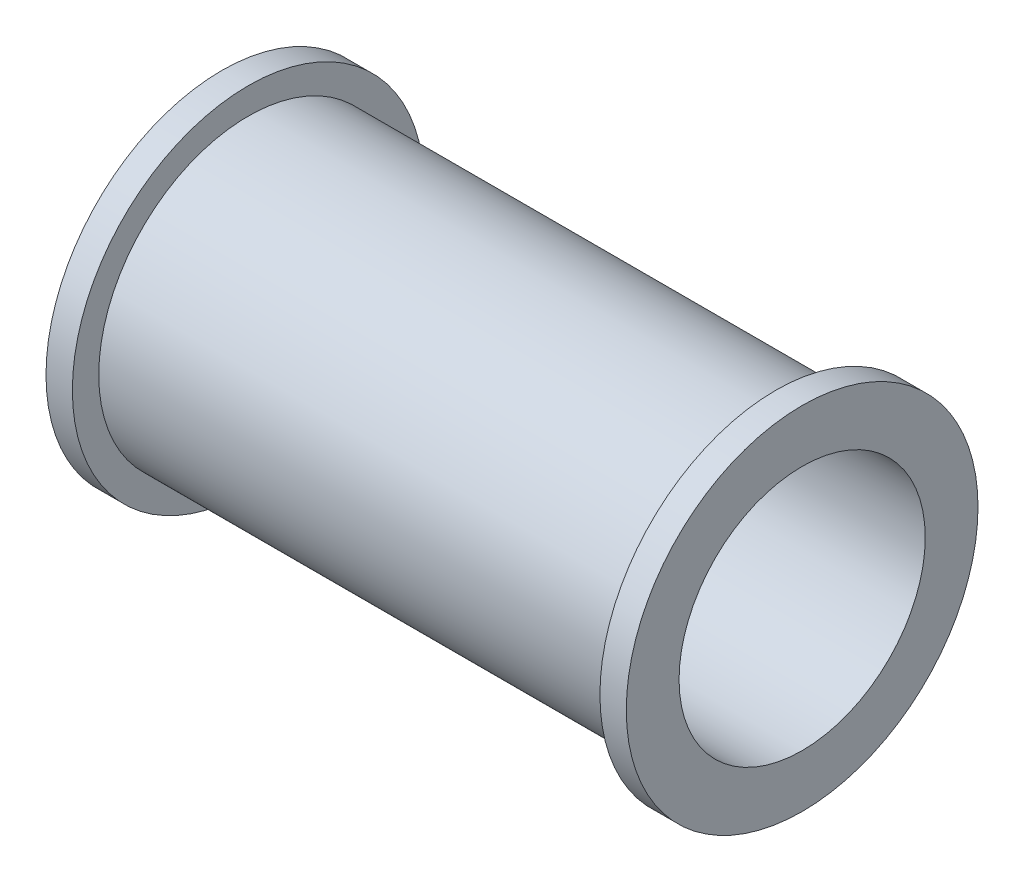
from build123d import *

# Parameters (mm, degrees)
SKETCH_3_R          = 7
CUT_EXTRUDE_1_DEPTH = 36.902646142


with BuildPart() as part:
    # Эскиз2 → Повернуть1 (revolve)
    with BuildSketch(Plane(origin=(0, 0, 0), x_dir=(1, 0, 0), z_dir=(0, 1, 0))):
        Polygon((0, 0), (0, 10), (1.5, 10), (1.5, 8.5), (31.5, 8.5), (31.5, 10), (33, 10), (33, 0), align=None)
    revolve(axis=Axis((33, 0, 0), (-1, 0, 0)))

    # Эскиз3 → Вырез-Вытянуть1 (cut, through all)
    with BuildSketch(Plane(origin=(33, 0, 0), x_dir=(0, 0, -1), z_dir=(1, 0, 0))):
        Circle(SKETCH_3_R)
    extrude(amount=-CUT_EXTRUDE_1_DEPTH, mode=Mode.SUBTRACT)


solid = part.part
